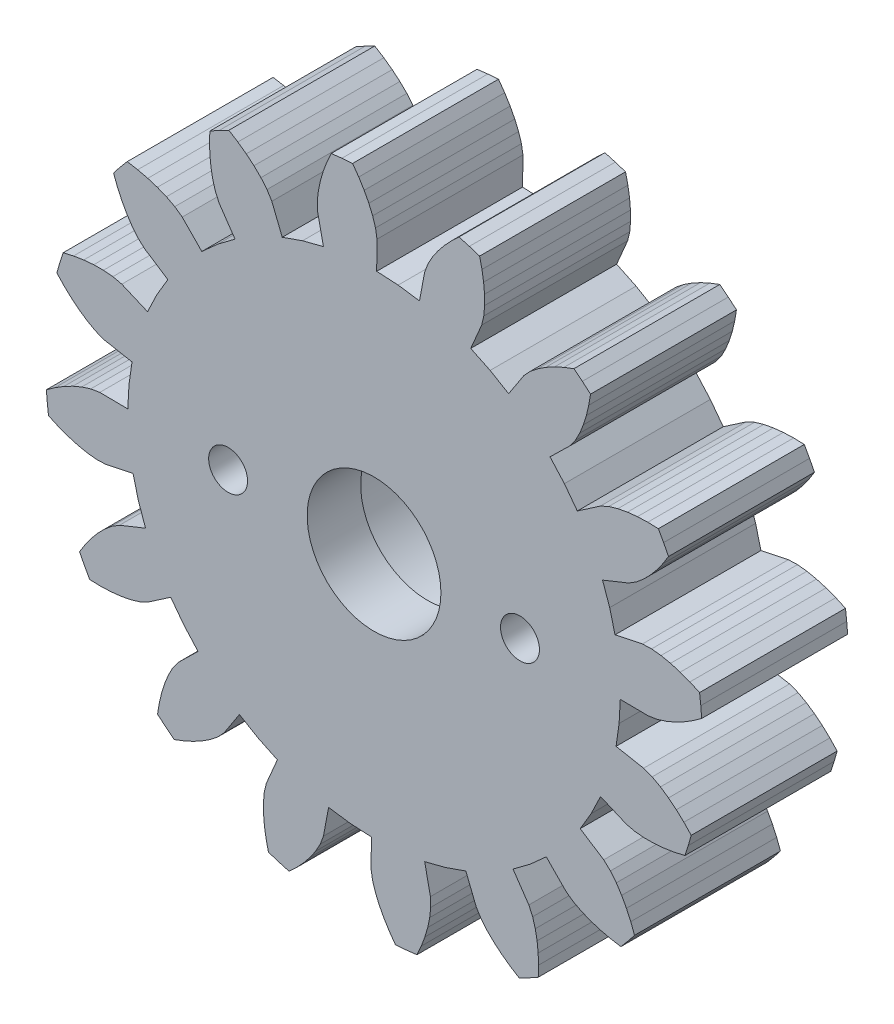
from build123d import *

# Parameters (mm, degrees)
BOSS_EXTRUDE1_START     = 14
BOSS_EXTRUDE1_DEPTH     = 6
CUT_EXTRUDE1_DEPTH      = 28.621462489
CUT_EXTRUDE1_DEPTH_BACK = 28.621462489
SKETCH2_R               = 2.75
CUT_EXTRUDE2_START      = 14
SKETCH3_R               = 3.8
CUT_EXTRUDE2_DEPTH      = 3.8
CUT_EXTRUDE3_DEPTH      = 28.621462489
CUT_EXTRUDE3_DEPTH_BACK = 28.621462489
SKETCH4_R               = 0.8


with BuildPart() as part:
    # Sketch1 → Boss-Extrude1 (new body)
    with BuildSketch(Plane.XY.offset(BOSS_EXTRUDE1_START)):
        Polygon((0.108717297, 10.124416307), (0.121079517, 11.275661384), (0.060578846, 11.646768663), (-0.056501696, 12.017408141), (-0.213545386, 12.386315054), (-0.405181151, 12.752335177), (-0.628518832, 13.114332652), (-0.881705726, 13.471176452), (-1.323231394, 13.43499381), (-1.763332154, 13.384343828), (-1.942037362, 12.984962368), (-2.090461467, 12.586349554), (-2.207008021, 12.189976122), (-2.289063992, 11.797519948), (-2.33158669, 11.411160923), (-2.318525418, 11.035381271), (-2.081803963, 9.908668794), (-2.939132357, 9.689020899), (-3.774004697, 9.395345313), (-4.203145914, 10.463687894), (-4.401057852, 10.783393709), (-4.651063756, 11.081015153), (-4.937327771, 11.361742681), (-5.254445969, 11.626565348), (-5.599313517, 11.875539776), (-5.969785917, 12.10833003), (-6.363855947, 11.905937069), (-6.751073123, 11.690723318), (-6.763338538, 11.253355439), (-6.747922011, 10.828285772), (-6.703911442, 10.417484036), (-6.629534798, 10.023500349), (-6.52096745, 9.650278421), (-6.365095762, 9.308101624), (-5.715219456, 8.357744407), (-6.423232002, 7.82673084), (-7.082168688, 7.235918164), (-7.88748048, 8.058712775), (-8.192673388, 8.278344814), (-8.537543522, 8.457638056), (-8.90944676, 8.607447978), (-9.303769019, 8.73075634), (-9.717663477, 8.828803621), (-10.149020318, 8.902100122), (-10.43564112, 8.564309336), (-10.711024407, 8.217296159), (-10.554982732, 7.808527156), (-10.378072599, 7.421713641), (-10.180205116, 7.05902444), (-9.960719028, 6.723493685), (-9.717590029, 6.42022851), (-9.442637975, 6.163747884), (-8.478544596, 5.534429197), (-8.929452802, 4.77289196), (-9.312136696, 3.974888069), (-10.371017644, 4.426871688), (-10.737028667, 4.512992964), (-11.124259679, 4.546662235), (-11.525183243, 4.542747348), (-11.936677576, 4.505768824), (-12.356587263, 4.437962148), (-12.783158377, 4.340606169), (-12.918694532, 3.918843143), (-13.04031932, 3.49286015), (-12.739726486, 3.174921399), (-12.428255712, 2.885252885), (-12.106654846, 2.625892364), (-11.775474079, 2.399896056), (-11.434797616, 2.212757008), (-11.082624155, 2.081019403), (-9.951088179, 1.868547312), (-10.076245358, 0.992423546), (-10.124416307, 0.108717297), (-11.275661384, 0.121079517), (-11.646768663, 0.060578846), (-12.017408141, -0.056501696), (-12.386315054, -0.213545386), (-12.752335177, -0.405181151), (-13.114332652, -0.628518832), (-13.471176452, -0.881705726), (-13.43499381, -1.323231394), (-13.384343828, -1.763332154), (-12.984962368, -1.942037362), (-12.586349554, -2.090461467), (-12.189976122, -2.207008021), (-11.797519948, -2.289063992), (-11.411160923, -2.33158669), (-11.035381271, -2.318525418), (-9.908668794, -2.081803963), (-9.689020899, -2.939132357), (-9.395345313, -3.774004697), (-10.463687894, -4.203145914), (-10.783393709, -4.401057852), (-11.081015153, -4.651063756), (-11.361742681, -4.937327771), (-11.626565348, -5.254445969), (-11.875539776, -5.599313517), (-12.10833003, -5.969785917), (-11.905937069, -6.363855947), (-11.690723318, -6.751073123), (-11.253355439, -6.763338538), (-10.828285772, -6.747922011), (-10.417484036, -6.703911442), (-10.023500349, -6.629534798), (-9.650278421, -6.52096745), (-9.308101624, -6.365095762), (-8.357744407, -5.715219456), (-7.82673084, -6.423232002), (-7.235918164, -7.082168688), (-8.058712775, -7.88748048), (-8.278344814, -8.192673388), (-8.457638056, -8.537543522), (-8.607447978, -8.90944676), (-8.73075634, -9.303769019), (-8.828803621, -9.717663477), (-8.902100122, -10.149020318), (-8.564309336, -10.43564112), (-8.217296159, -10.711024407), (-7.808527156, -10.554982732), (-7.421713641, -10.378072599), (-7.05902444, -10.180205116), (-6.723493685, -9.960719028), (-6.42022851, -9.717590029), (-6.163747884, -9.442637975), (-5.534429197, -8.478544596), (-4.77289196, -8.929452802), (-3.974888069, -9.312136696), (-4.426871688, -10.371017644), (-4.512992964, -10.737028667), (-4.546662235, -11.124259679), (-4.542747348, -11.525183243), (-4.505768824, -11.936677576), (-4.437962148, -12.356587263), (-4.340606169, -12.783158377), (-3.918843143, -12.918694532), (-3.49286015, -13.04031932), (-3.174921399, -12.739726486), (-2.885252885, -12.428255712), (-2.625892364, -12.106654846), (-2.399896056, -11.775474079), (-2.212757008, -11.434797616), (-2.081019403, -11.082624155), (-1.868547312, -9.951088179), (-0.992423546, -10.076245358), (-0.108717297, -10.124416307), (-0.121079517, -11.275661384), (-0.060578846, -11.646768663), (0.056501696, -12.017408141), (0.213545386, -12.386315054), (0.405181151, -12.752335177), (0.628518832, -13.114332652), (0.881705726, -13.471176452), (1.323231394, -13.43499381), (1.763332154, -13.384343828), (1.942037362, -12.984962368), (2.090461467, -12.586349554), (2.207008021, -12.189976122), (2.289063992, -11.797519948), (2.33158669, -11.411160923), (2.318525418, -11.035381271), (2.081803963, -9.908668794), (2.939132357, -9.689020899), (3.774004697, -9.395345313), (4.203145914, -10.463687894), (4.401057852, -10.783393709), (4.651063756, -11.081015153), (4.937327771, -11.361742681), (5.254445969, -11.626565348), (5.599313517, -11.875539776), (5.969785917, -12.10833003), (6.363855947, -11.905937069), (6.751073123, -11.690723318), (6.763338538, -11.253355439), (6.747922011, -10.828285772), (6.703911442, -10.417484036), (6.629534798, -10.023500349), (6.52096745, -9.650278421), (6.365095762, -9.308101624), (5.715219456, -8.357744407), (6.423232002, -7.82673084), (7.082168688, -7.235918164), (7.88748048, -8.058712775), (8.192673388, -8.278344814), (8.537543522, -8.457638056), (8.90944676, -8.607447978), (9.303769019, -8.73075634), (9.717663477, -8.828803621), (10.149020318, -8.902100122), (10.43564112, -8.564309336), (10.711024407, -8.217296159), (10.554982732, -7.808527156), (10.378072599, -7.421713641), (10.180205116, -7.05902444), (9.960719028, -6.723493685), (9.717590029, -6.42022851), (9.442637975, -6.163747884), (8.478544596, -5.534429197), (8.929452802, -4.77289196), (9.312136696, -3.974888069), (10.371017644, -4.426871688), (10.737028667, -4.512992964), (11.124259679, -4.546662235), (11.525183243, -4.542747348), (11.936677576, -4.505768824), (12.356587263, -4.437962148), (12.783158377, -4.340606169), (12.918694532, -3.918843143), (13.04031932, -3.49286015), (12.739726486, -3.174921399), (12.428255712, -2.885252885), (12.106654846, -2.625892364), (11.775474079, -2.399896056), (11.434797616, -2.212757008), (11.082624155, -2.081019403), (9.951088179, -1.868547312), (10.076245358, -0.992423546), (10.124416307, -0.108717297), (11.275661384, -0.121079517), (11.646768663, -0.060578846), (12.017408141, 0.056501696), (12.386315054, 0.213545386), (12.752335177, 0.405181151), (13.114332652, 0.628518832), (13.471176452, 0.881705726), (13.43499381, 1.323231394), (13.384343828, 1.763332154), (12.984962368, 1.942037362), (12.586349554, 2.090461467), (12.189976122, 2.207008021), (11.797519948, 2.289063992), (11.411160923, 2.33158669), (11.035381271, 2.318525418), (9.908668794, 2.081803963), (9.689020899, 2.939132357), (9.395345313, 3.774004697), (10.463687894, 4.203145914), (10.783393709, 4.401057852), (11.081015153, 4.651063756), (11.361742681, 4.937327771), (11.626565348, 5.254445969), (11.875539776, 5.599313517), (12.10833003, 5.969785917), (11.905937069, 6.363855947), (11.690723318, 6.751073123), (11.253355439, 6.763338538), (10.828285772, 6.747922011), (10.417484036, 6.703911442), (10.023500349, 6.629534798), (9.650278421, 6.52096745), (9.308101624, 6.365095762), (8.357744407, 5.715219456), (7.82673084, 6.423232002), (7.235918164, 7.082168688), (8.058712775, 7.88748048), (8.278344814, 8.192673388), (8.457638056, 8.537543522), (8.607447978, 8.90944676), (8.73075634, 9.303769019), (8.828803621, 9.717663477), (8.902100122, 10.149020318), (8.564309336, 10.43564112), (8.217296159, 10.711024407), (7.808527156, 10.554982732), (7.421713641, 10.378072599), (7.05902444, 10.180205116), (6.723493685, 9.960719028), (6.42022851, 9.717590029), (6.163747884, 9.442637975), (5.534429197, 8.478544596), (4.77289196, 8.929452802), (3.974888069, 9.312136696), (4.426871688, 10.371017644), (4.512992964, 10.737028667), (4.546662235, 11.124259679), (4.542747348, 11.525183243), (4.505768824, 11.936677576), (4.437962148, 12.356587263), (4.340606169, 12.783158377), (3.918843143, 12.918694532), (3.49286015, 13.04031932), (3.174921399, 12.739726486), (2.885252885, 12.428255712), (2.625892364, 12.106654846), (2.399896056, 11.775474079), (2.212757008, 11.434797616), (2.081019403, 11.082624155), (1.868547312, 9.951088179), (0.992423546, 10.076245358), align=None)
    extrude(amount=BOSS_EXTRUDE1_DEPTH)

    # Sketch2 → Cut-Extrude1 (cut, two sides: drawn at the far end of the back side and taken through both)
    with BuildSketch(Plane.XY.offset(-CUT_EXTRUDE1_DEPTH_BACK)):
        Circle(SKETCH2_R)
    extrude(amount=CUT_EXTRUDE1_DEPTH + CUT_EXTRUDE1_DEPTH_BACK, mode=Mode.SUBTRACT)

    # Sketch3 → Cut-Extrude2 (cut)
    with BuildSketch(Plane.XY.offset(CUT_EXTRUDE2_START)):
        with Locations(Location((0, 0, 0), (0, 0, 180))):
            Circle(SKETCH3_R)
    extrude(amount=CUT_EXTRUDE2_DEPTH, mode=Mode.SUBTRACT)

    # Sketch4 → Cut-Extrude3 (cut, two sides: drawn at the far end of the back side and taken through both)
    with BuildSketch(Plane.XY.offset(-CUT_EXTRUDE3_DEPTH_BACK)):
        with Locations((6, 0)):
            Circle(SKETCH4_R)
        with Locations((-6, 0)):
            Circle(SKETCH4_R)
    extrude(amount=CUT_EXTRUDE3_DEPTH + CUT_EXTRUDE3_DEPTH_BACK, mode=Mode.SUBTRACT)


solid = part.part
